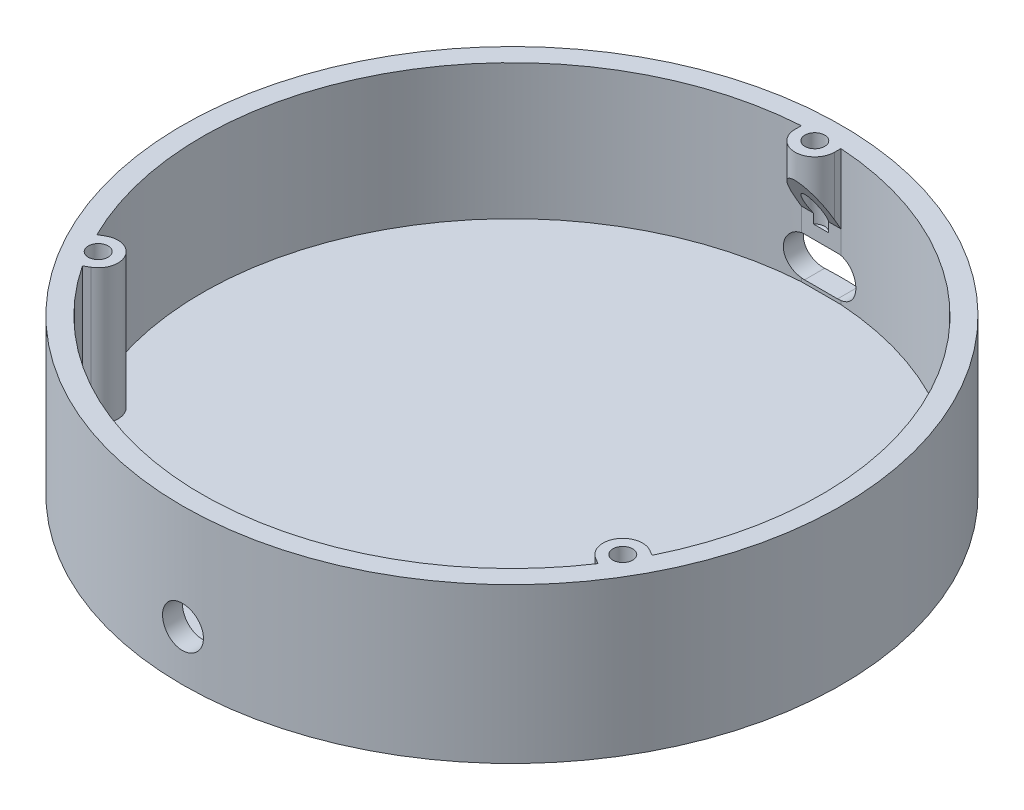
from build123d import *

# Parameters (mm, degrees)
SKETCH2_R               = 50
BOSS_EXTRUDE1_DEPTH     = 23.5
SKETCH3_R               = 47
CUT_EXTRUDE1_DEPTH      = 20.5
BOSS_EXTRUDE2_DEPTH     = 20.5
SKETCH7_R               = 1.5
CUT_EXTRUDE3_DEPTH      = 12
SKETCH8_R               = 3.1
CUT_EXTRUDE4_DEPTH      = 75.51342161
CUT_EXTRUDE5_REACH      = 78.559
CUT_EXTRUDE5_END_RADIUS = 47
CUT_EXTRUDE6_DEPTH      = 75.513421776


with BuildPart() as part:
    # Sketch2 → Boss-Extrude1 (new body)
    with BuildSketch(Plane(origin=(0, 0, 0), x_dir=(1, 0, 0), z_dir=(0, 1, 0))):
        with Locations(Location((0, 0, 0), (0, 0, 270))):
            Circle(SKETCH2_R)
    extrude(amount=BOSS_EXTRUDE1_DEPTH)

    # Sketch3 → Cut-Extrude1 (cut)
    with BuildSketch(Plane(origin=(0, 23.5, 0), x_dir=(1, 0, 0), z_dir=(0, 1, 0))):
        with Locations(Location((0, 0, 0), (0, 0, 270))):
            Circle(SKETCH3_R)
    extrude(amount=-CUT_EXTRUDE1_DEPTH, mode=Mode.SUBTRACT)

    # Sketch4 → Boss-Extrude2 (add)
    with BuildSketch(Plane(origin=(0, 3, 0), x_dir=(1, 0, 0), z_dir=(0, 1, 0))):
        with BuildLine():
            Line((3, 48.95), (-3, 48.95))
            Line((-3, 48.95), (-3, 45.95))
            ThreePointArc((-3, 45.95), (0, 42.95), (3, 45.95))
            Line((3, 45.95), (3, 48.95))
        make_face()
        with BuildLine():
            Line((43.891943515, -21.876923789), (41.293867304, -20.376923789))
            ThreePointArc((41.293867304, -20.376923789), (37.195791093, -21.475), (38.293867304, -25.573076211))
            Line((38.293867304, -25.573076211), (40.891943515, -27.073076211))
            Line((40.891943515, -27.073076211), (43.891943515, -21.876923789))
        make_face()
        with BuildLine():
            Line((-40.891943515, -27.073076211), (-38.293867304, -25.573076211))
            ThreePointArc((-38.293867304, -25.573076211), (-37.195791093, -21.475), (-41.293867304, -20.376923789))
            Line((-41.293867304, -20.376923789), (-43.891943515, -21.876923789))
            Line((-43.891943515, -21.876923789), (-40.891943515, -27.073076211))
        make_face()
    extrude(amount=BOSS_EXTRUDE2_DEPTH)

    # Sketch7 → Cut-Extrude3 (cut)
    with BuildSketch(Plane(origin=(0, 23.5, 0), x_dir=(1, 0, 0), z_dir=(0, 1, 0))):
        with Locations(Location((0, 45.95, 0), (0, 0, 270))):
            Circle(SKETCH7_R)
        with Locations(Location((39.793867304, -22.975, 0), (0, 0, 270))):
            Circle(SKETCH7_R)
        with Locations(Location((-39.793867304, -22.975, 0), (0, 0, 270))):
            Circle(SKETCH7_R)
    extrude(amount=-CUT_EXTRUDE3_DEPTH, mode=Mode.SUBTRACT)

    # Sketch8 → Cut-Extrude4 (cut, through all)
    with BuildSketch(Plane.XY):
        with Locations(Location((0, 7.6, 0), (0, 0, 180))):
            Circle(SKETCH8_R)
    extrude(amount=CUT_EXTRUDE4_DEPTH, mode=Mode.SUBTRACT)

    # Cut-Extrude5: up to this cylinder (the profile starts inside it)
    cut_extrude5_end = Plane(origin=(0, 10.013188, 0), z_dir=(0, 1, 0)) * Cylinder(CUT_EXTRUDE5_END_RADIUS, 252.118, mode=Mode.PRIVATE)
    # Sketch9 → Cut-Extrude5 (cut, up to the surface)
    with BuildSketch(Plane(origin=(3, 0, 0), x_dir=(0, 0, -1), z_dir=(1, 0, 0)), mode=Mode.PRIVATE) as cut_extrude5_sk1:
        Polygon((46.904157598, 12.941577654), (42.581578264, 20.428504681), (42.581578264, 3), (46.904157598, 3), align=None)
    cut_extrude5_tool1 = extrude(cut_extrude5_sk1.sketch, amount=-CUT_EXTRUDE5_REACH, mode=Mode.PRIVATE) & cut_extrude5_end
    add(cut_extrude5_tool1.solids().sort_by_distance((3, 10.013188, -44.545799))[0], mode=Mode.SUBTRACT)

    # Sketch11 → Cut-Extrude6 (cut, through all)
    with BuildSketch(Plane.XY):
        with BuildLine():
            Line((-2.5, 9.5), (2.5, 9.5))
            ThreePointArc((2.5, 9.5), (5.5, 6.5), (2.5, 3.5))
            Line((2.5, 3.5), (-2.5, 3.5))
            ThreePointArc((-2.5, 3.5), (-5.5, 6.5), (-2.5, 9.5))
        make_face()
    extrude(amount=-CUT_EXTRUDE6_DEPTH, mode=Mode.SUBTRACT)


solid = part.part
